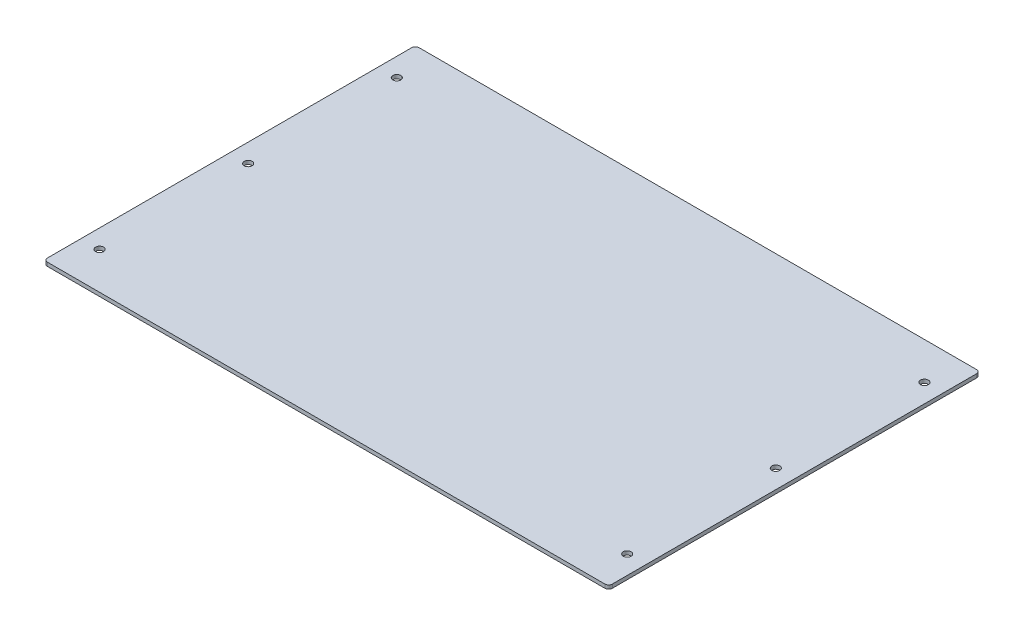
from build123d import *

# Parameters (mm, degrees)
BOSS_EXTRUDE1_DEPTH              = 3.175
F_17_64_0_26563_DIAMETER_HOLE1_D = 6.747002


with BuildPart() as part:
    # Sketch1 → Boss-Extrude1 (new body)
    with BuildSketch(Plane(origin=(0, 0, 0), x_dir=(1, 0, 0), z_dir=(0, 1, 0))):
        with BuildLine():
            Line((-238.125, -158.75), (238.125, -158.75))
            ThreePointArc((238.125, -158.75), (240.37006403, -157.82006403), (241.3, -155.575))
            Line((241.3, -155.575), (241.3, 155.575))
            ThreePointArc((241.3, 155.575), (240.37006403, 157.82006403), (238.125, 158.75))
            Line((238.125, 158.75), (-238.125, 158.75))
            ThreePointArc((-238.125, 158.75), (-240.37006403, 157.82006403), (-241.3, 155.575))
            Line((-241.3, 155.575), (-241.3, -155.575))
            ThreePointArc((-241.3, -155.575), (-240.37006403, -157.82006403), (-238.125, -158.75))
        make_face()
    extrude(amount=BOSS_EXTRUDE1_DEPTH)

    # 17/64 (0.26563) Diameter Hole1 (through all)
    with Locations(Plane(origin=(0, 3.175, 0), x_dir=(1, 0, 0), z_dir=(0, 1, 0))):
        with Locations((-225.425, 127), (-225.425, 0), (-225.425, -127), (225.425, 127), (225.425, 0), (225.425, -127)):
            Hole(F_17_64_0_26563_DIAMETER_HOLE1_D / 2)


solid = part.part
